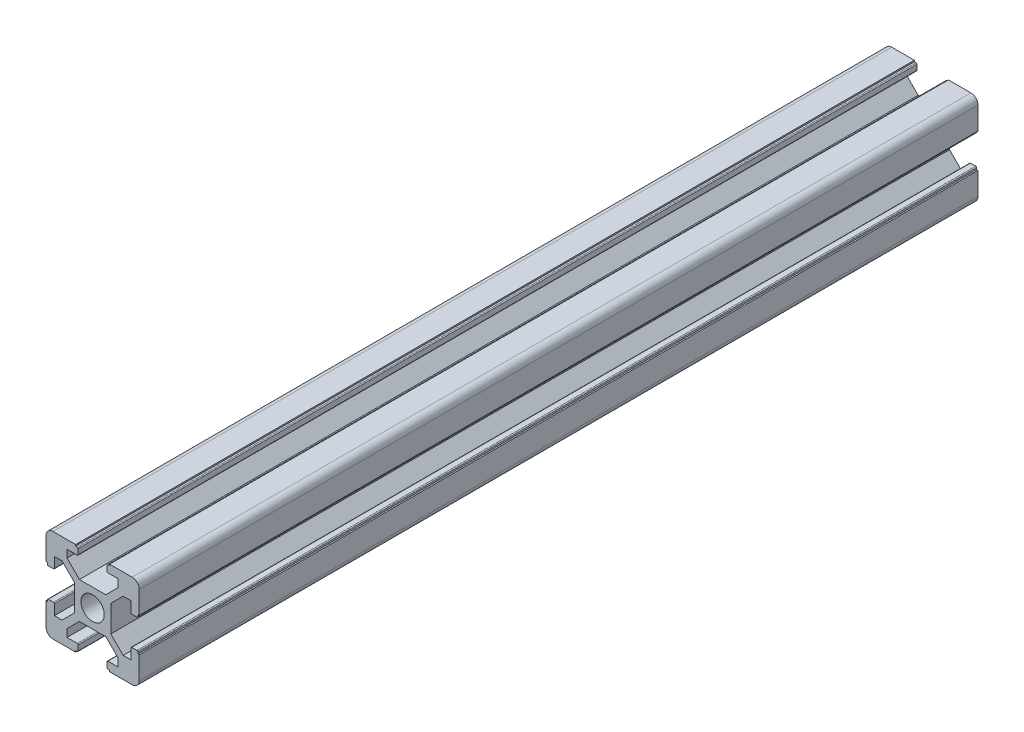
from build123d import *

# Parameters (mm, degrees)
SKETCH_1_R      = 2.5
EXTRUDE_2_DEPTH = 180
EXTRUDE_3_DEPTH = 180


with BuildPart() as part:
    # 草图1 → 凸台-拉伸2 (new body)
    with BuildSketch(Plane.XY):
        with BuildLine():
            Line((3.65, 10), (8.5, 10))
            ThreePointArc((8.5, 10), (9.560660172, 9.560660172), (10, 8.5))
            Line((10, 8.5), (10, 3.65))
            Line((10, 3.65), (8.2, 3.65))
            Line((8.2, 3.65), (8.2, 5.5))
            Line((8.2, 5.5), (6.560660172, 5.5))
            Line((6.560660172, 5.5), (3.9, 2.839339828))
            Line((3.9, 2.839339828), (3.9, -2.839339828))
            Line((3.9, -2.839339828), (6.560660172, -5.5))
            Line((6.560660172, -5.5), (8.2, -5.5))
            Line((8.2, -5.5), (8.2, -3.65))
            Line((8.2, -3.65), (10, -3.65))
            Line((10, -3.65), (10, -8.5))
            ThreePointArc((10, -8.5), (9.560660172, -9.560660172), (8.5, -10))
            Line((8.5, -10), (3.65, -10))
            Line((3.65, -10), (3.65, -8.2))
            Line((3.65, -8.2), (5.5, -8.2))
            Line((5.5, -8.2), (5.5, -6.560660172))
            Line((5.5, -6.560660172), (2.839339828, -3.9))
            Line((2.839339828, -3.9), (-2.839339828, -3.9))
            Line((-2.839339828, -3.9), (-5.5, -6.560660172))
            Line((-5.5, -6.560660172), (-5.5, -8.2))
            Line((-5.5, -8.2), (-3.65, -8.2))
            Line((-3.65, -8.2), (-3.65, -10))
            Line((-3.65, -10), (-8.5, -10))
            ThreePointArc((-8.5, -10), (-9.560660172, -9.560660172), (-10, -8.5))
            Line((-10, -8.5), (-10, -3.65))
            Line((-10, -3.65), (-8.2, -3.65))
            Line((-8.2, -3.65), (-8.2, -5.5))
            Line((-8.2, -5.5), (-6.560660172, -5.5))
            Line((-6.560660172, -5.5), (-3.9, -2.839339828))
            Line((-3.9, -2.839339828), (-3.9, 2.839339828))
            Line((-3.9, 2.839339828), (-6.560660172, 5.5))
            Line((-6.560660172, 5.5), (-8.2, 5.5))
            Line((-8.2, 5.5), (-8.2, 3.65))
            Line((-8.2, 3.65), (-10, 3.65))
            Line((-10, 3.65), (-10, 8.5))
            ThreePointArc((-10, 8.5), (-9.560660172, 9.560660172), (-8.5, 10))
            Line((-8.5, 10), (-3.65, 10))
            Line((-3.65, 10), (-3.65, 8.2))
            Line((-3.65, 8.2), (-5.5, 8.2))
            Line((-5.5, 8.2), (-5.5, 6.560660172))
            Line((-5.5, 6.560660172), (-2.839339828, 3.9))
            Line((-2.839339828, 3.9), (2.839339828, 3.9))
            Line((2.839339828, 3.9), (5.5, 6.560660172))
            Line((5.5, 6.560660172), (5.5, 8.2))
            Line((5.5, 8.2), (3.65, 8.2))
            Line((3.65, 8.2), (3.65, 10))
        make_face()
        with Locations(Location((0, 0, 0), (0, 0, 180))):
            Circle(SKETCH_1_R, mode=Mode.SUBTRACT)
    extrude(amount=EXTRUDE_2_DEPTH)

    # 草图3 → 凸台-拉伸3 (add)
    with BuildSketch(Plane.XY.offset(180)):
        with BuildLine():
            Line((-8.2, 3.65), (-9.7, 3.65))
            Line((-9.7, 3.65), (-9.7, 3.3))
            ThreePointArc((-9.7, 3.3), (-9.641421356, 3.158578644), (-9.5, 3.1))
            Line((-9.5, 3.1), (-8.4, 3.1))
            ThreePointArc((-8.4, 3.1), (-8.258578644, 3.158578644), (-8.2, 3.3))
            Line((-8.2, 3.3), (-8.2, 3.65))
        make_face()
        with BuildLine():
            Line((-3.65, 9.7), (-3.65, 8.2))
            Line((-3.65, 8.2), (-3.3, 8.2))
            ThreePointArc((-3.3, 8.2), (-3.158578644, 8.258578644), (-3.1, 8.4))
            Line((-3.1, 8.4), (-3.1, 9.5))
            ThreePointArc((-3.1, 9.5), (-3.158578644, 9.641421356), (-3.3, 9.7))
            Line((-3.3, 9.7), (-3.65, 9.7))
        make_face()
        with BuildLine():
            Line((3.65, 8.2), (3.65, 9.7))
            Line((3.65, 9.7), (3.3, 9.7))
            ThreePointArc((3.3, 9.7), (3.158578644, 9.641421356), (3.1, 9.5))
            Line((3.1, 9.5), (3.1, 8.4))
            ThreePointArc((3.1, 8.4), (3.158578644, 8.258578644), (3.3, 8.2))
            Line((3.3, 8.2), (3.65, 8.2))
        make_face()
        with BuildLine():
            Line((9.7, 3.65), (8.2, 3.65))
            Line((8.2, 3.65), (8.2, 3.3))
            ThreePointArc((8.2, 3.3), (8.258578644, 3.158578644), (8.4, 3.1))
            Line((8.4, 3.1), (9.5, 3.1))
            ThreePointArc((9.5, 3.1), (9.641421356, 3.158578644), (9.7, 3.3))
            Line((9.7, 3.3), (9.7, 3.65))
        make_face()
        with BuildLine():
            Line((3.65, -9.7), (3.65, -8.2))
            Line((3.65, -8.2), (3.3, -8.2))
            ThreePointArc((3.3, -8.2), (3.158578644, -8.258578644), (3.1, -8.4))
            Line((3.1, -8.4), (3.1, -9.5))
            ThreePointArc((3.1, -9.5), (3.158578644, -9.641421356), (3.3, -9.7))
            Line((3.3, -9.7), (3.65, -9.7))
        make_face()
        with BuildLine():
            Line((-3.65, -8.2), (-3.65, -9.7))
            Line((-3.65, -9.7), (-3.3, -9.7))
            ThreePointArc((-3.3, -9.7), (-3.158578644, -9.641421356), (-3.1, -9.5))
            Line((-3.1, -9.5), (-3.1, -8.4))
            ThreePointArc((-3.1, -8.4), (-3.158578644, -8.258578644), (-3.3, -8.2))
            Line((-3.3, -8.2), (-3.65, -8.2))
        make_face()
        with BuildLine():
            Line((8.2, -3.65), (8.2, -3.3))
            ThreePointArc((8.2, -3.3), (8.258578644, -3.158578644), (8.4, -3.1))
            Line((8.4, -3.1), (9.5, -3.1))
            ThreePointArc((9.5, -3.1), (9.641421356, -3.158578644), (9.7, -3.3))
            Line((9.7, -3.3), (9.7, -3.65))
            Line((9.7, -3.65), (8.2, -3.65))
        make_face()
        with BuildLine():
            Line((-8.2, -3.65), (-8.2, -3.3))
            ThreePointArc((-8.2, -3.3), (-8.258578644, -3.158578644), (-8.4, -3.1))
            Line((-8.4, -3.1), (-9.5, -3.1))
            ThreePointArc((-9.5, -3.1), (-9.641421356, -3.158578644), (-9.7, -3.3))
            Line((-9.7, -3.3), (-9.7, -3.65))
            Line((-9.7, -3.65), (-8.2, -3.65))
        make_face()
    extrude(amount=-EXTRUDE_3_DEPTH)


solid = part.part
